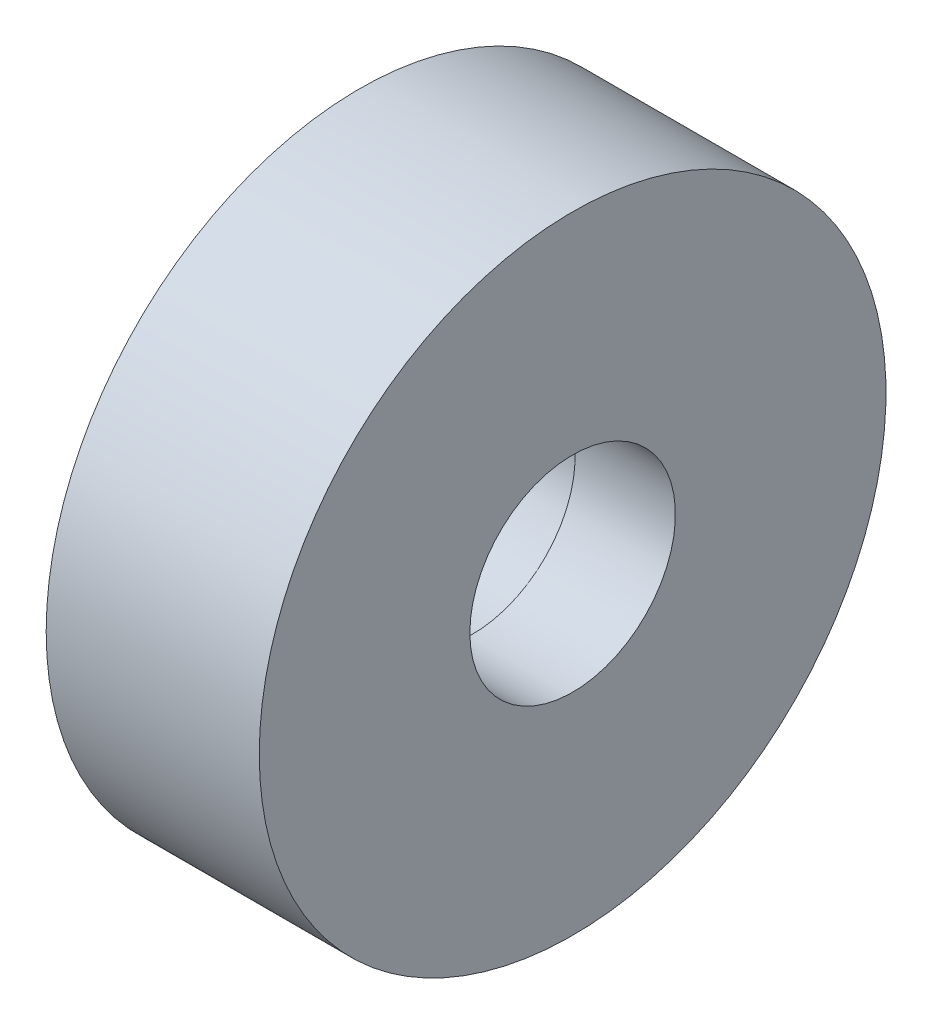
from build123d import *


with BuildPart() as part:
    # Sketch1 → Revolve1 (revolve)
    with BuildSketch(Plane.XY, mode=Mode.PRIVATE) as revolve1_sk:
        Polygon((-4.25, 12.5), (4.25, 12.5), (4.25, 4.1), (0.25, 4.1), (0.25, 4.15), (-4.25, 4.15), align=None)
    revolve(revolve1_sk.sketch.rotate(Axis((0, 0, 0), (1, 0, 0)), 90), axis=Axis((0, 0, 0), (1, 0, 0)))


solid = part.part
